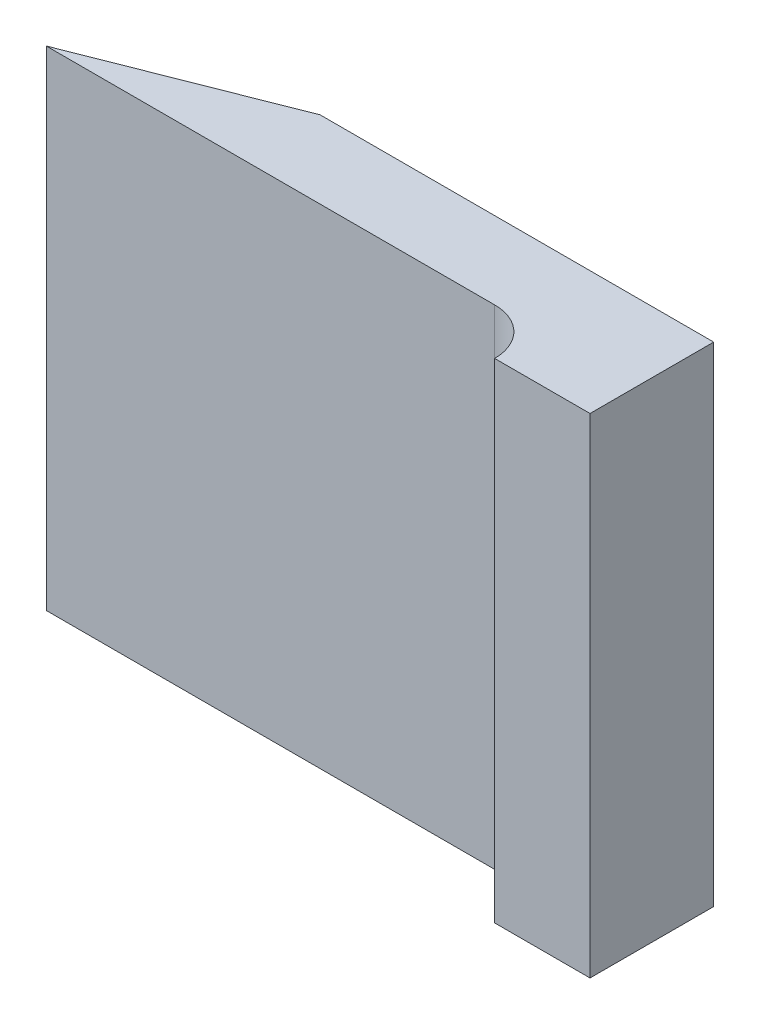
from build123d import *

# Parameters (mm, degrees)
SKETCH1_W           = 48.472676838
SKETCH1_H           = 40.157820008
BOSS_EXTRUDE1_DEPTH = 12.7
SKETCH3_W           = 40.64
SKETCH3_H           = 40.157820008
CUT_EXTRUDE2_DEPTH  = 6.35
FILLET7_R           = 3.81
SKETCH4_W           = 7.832676838
SKETCH4_H           = 40.157820008
CUT_EXTRUDE3_DEPTH  = 2.54
CUT_EXTRUDE4_DEPTH  = 129.54


with BuildPart() as part:
    # Sketch1 → Boss-Extrude1 (new body)
    with BuildSketch(Plane.XY):
        with Locations((5.884543073, 14.710946933)):
            Rectangle(SKETCH1_W, SKETCH1_H)
    extrude(amount=BOSS_EXTRUDE1_DEPTH)

    # Sketch3 → Cut-Extrude2 (cut)
    with BuildSketch(Plane.XY.offset(12.7)):
        with Locations((1.968204654, 14.710946933)):
            Rectangle(SKETCH3_W, SKETCH3_H)
    extrude(amount=-CUT_EXTRUDE2_DEPTH, mode=Mode.SUBTRACT)

    # Fillet7
    fillet7_edges = [part.edges().sort_by_distance(p)[0] for p in [
        (22.288204654, 14.710946933, 6.35),
    ]]
    fillet(fillet7_edges, radius=FILLET7_R)

    # Sketch4 → Cut-Extrude3 (cut)
    with BuildSketch(Plane.XY.offset(12.7)):
        with Locations((26.204543073, 14.710946933)):
            Rectangle(SKETCH4_W, SKETCH4_H)
    extrude(amount=-CUT_EXTRUDE3_DEPTH, mode=Mode.SUBTRACT)

    # Sketch5 → Cut-Extrude4 (cut)
    with BuildSketch(Plane(origin=(0, 34.789856937, 0), x_dir=(1, 0, 0), z_dir=(0, 1, 0))):
        Polygon((-18.351795346, 0), (-18.351795346, -6.35), (-2.210194986, 0), align=None)
    extrude(amount=-CUT_EXTRUDE4_DEPTH, mode=Mode.SUBTRACT)


solid = part.part
